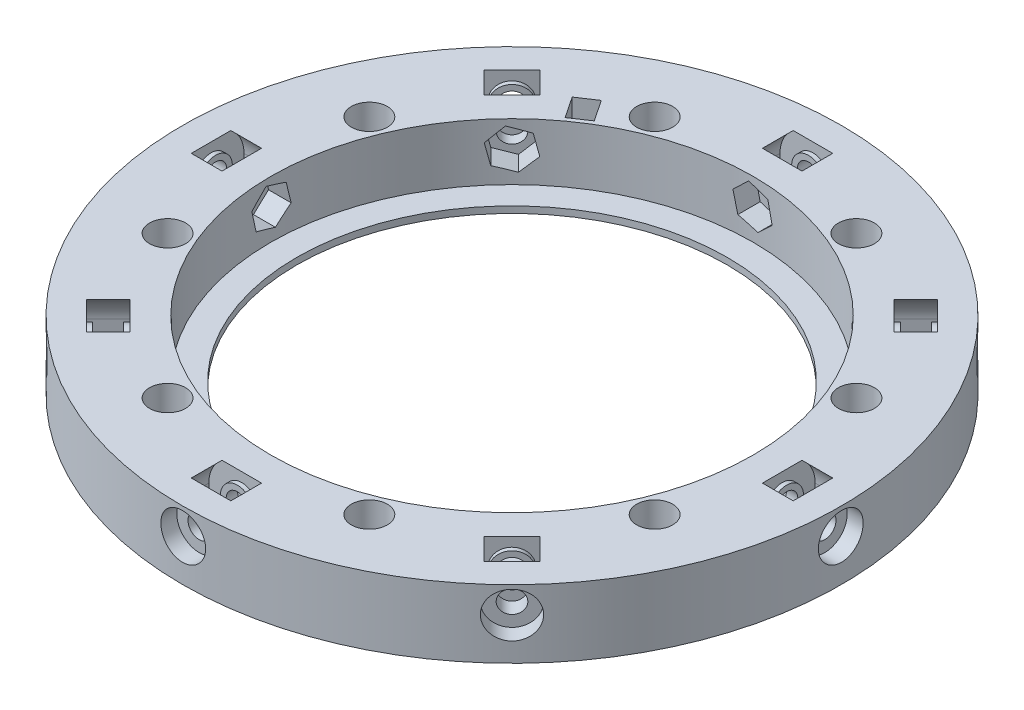
from build123d import *

# Parameters (mm, degrees)
SKETCH1_R                = 75
SKETCH1_R_2              = 54.925
EXTRUDE_THIN1_DEPTH      = 15.5
CUT_EXTRUDE1_START       = -6.5
CUT_EXTRUDE1_DEPTH       = 7
SKETCH3_R                = 4.1
CUT_EXTRUDE2_DEPTH       = 7.1
SKETCH4_R                = 2.05
CUT_EXTRUDE3_DEPTH       = 108.192583699
CIRPATTERN2_COUNT        = 8
CUT_EXTRUDE4_REACH       = 170.42
CUT_EXTRUDE4_END_RADIUS  = 54.925
SKETCH5_R                = 2.55
SKETCH6_R                = 5.1
CUT_EXTRUDE5_DEPTH       = 3.8
CUT_EXTRUDE6_REACH       = 185.52
CUT_EXTRUDE6_END_RADIUS  = 54.925
CUT_EXTRUDE6_START       = -15.1
BOSS_EXTRUDE1_DEPTH      = 1
BOSS_EXTRUDE1_DEPTH_BACK = 1
BOSS_EXTRUDE1_START      = -6.5
SKETCH8_R                = 3.85
SKETCH8_R_2              = 2.55
BOSS_EXTRUDE2_DEPTH      = 1
BOSS_EXTRUDE2_DEPTH_BACK = 1
BOSS_EXTRUDE2_START      = -13.5
SKETCH9_R                = 3.85
SKETCH9_R_2              = 2.55
CIRPATTERN5_COUNT        = 8
CIRPATTERN13_COUNT       = 8
CUT_EXTRUDE8_DEPTH       = 3.66
CUT_EXTRUDE9_REACH       = 108.725
BOSS_EXTRUDE3_START      = -1
SKETCH13_R               = 54.925
SKETCH13_R_2             = 49
BOSS_EXTRUDE3_DEPTH      = 1.5


with BuildPart() as part:
    # Sketch1 → Extrude-Thin1 (new body)
    with BuildSketch(Plane(origin=(0, 0, 0), x_dir=(1, 0, 0), z_dir=(0, 1, 0))):
        Circle(SKETCH1_R)
        Circle(SKETCH1_R_2, mode=Mode.SUBTRACT)
    extrude(amount=EXTRUDE_THIN1_DEPTH)

    # Sketch2 → Cut-Extrude1 (cut)
    with BuildSketch(Plane.XY.offset(75).offset(CUT_EXTRUDE1_START)):
        with BuildLine():
            Line((-7.5, 9.5), (-7.5, 0))
            Line((-7.5, 0), (7.5, 0))
            Line((7.5, 0), (7.5, 9.5))
            ThreePointArc((7.5, 9.5), (0, 17), (-7.5, 9.5))
        make_face()
    cut_extrude1 = extrude(amount=-CUT_EXTRUDE1_DEPTH, mode=Mode.SUBTRACT)

    # Sketch3 → Cut-Extrude2 (cut)
    with BuildSketch(Plane(origin=(0, 15.5, 0), x_dir=(1, 0, 0), z_dir=(0, 1, 0))):
        with Locations(Location((-22.961005942, 55.432771951, 0), (0, 0, 270))):
            Circle(SKETCH3_R)
    cut_extrude2 = extrude(amount=-CUT_EXTRUDE2_DEPTH, mode=Mode.SUBTRACT)

    # Sketch4 → Cut-Extrude3 (cut, through all)
    with BuildSketch(Plane(origin=(0, 15.5, 0), x_dir=(1, 0, 0), z_dir=(0, 1, 0))):
        with Locations(Location((-22.961005942, 55.432771951, 0), (0, 0, 270))):
            Circle(SKETCH4_R)
    cut_extrude3 = extrude(amount=-CUT_EXTRUDE3_DEPTH, mode=Mode.SUBTRACT)

    # CirPattern2: Cut-Extrude2, Cut-Extrude3 ×8 about axis
    cirpattern2_axis = Axis((0, 0, 0), (0, 1, 0))
    add([cut_extrude2.rotate(cirpattern2_axis, i * 360 / CIRPATTERN2_COUNT) for i in range(1, CIRPATTERN2_COUNT)], mode=Mode.SUBTRACT)
    add([cut_extrude3.rotate(cirpattern2_axis, i * 360 / CIRPATTERN2_COUNT) for i in range(1, CIRPATTERN2_COUNT)], mode=Mode.SUBTRACT)

    # Cut-Extrude4: up to this cylinder (the profile starts outside it)
    cut_extrude4_end = Plane(origin=(0, 9.5, 0), z_dir=(0, -1, 0)) * Cylinder(CUT_EXTRUDE4_END_RADIUS, 451.69, mode=Mode.PRIVATE)
    # Sketch5 → Cut-Extrude4 (cut, up to the surface)
    with BuildSketch(Plane.XY.offset(75), mode=Mode.PRIVATE) as cut_extrude4_sk1:
        with Locations((0, 9.5)):
            Circle(SKETCH5_R)
    cut_extrude4_tool1 = extrude(cut_extrude4_sk1.sketch, amount=-CUT_EXTRUDE4_REACH, mode=Mode.PRIVATE) - cut_extrude4_end
    cut_extrude4 = cut_extrude4_tool1.solids().sort_by_distance((0, 9.5, 75))[0]
    add(cut_extrude4, mode=Mode.SUBTRACT)

    # Sketch6 → Cut-Extrude5 (cut)
    with BuildSketch(Plane.XY.offset(75)):
        with Locations((0, 9.5)):
            Circle(SKETCH6_R)
    cut_extrude5 = extrude(amount=-CUT_EXTRUDE5_DEPTH, mode=Mode.SUBTRACT)

    # Cut-Extrude6: up to this cylinder (the profile starts outside it)
    cut_extrude6_end = Plane(origin=(0, 9.5, 0), z_dir=(0, -1, 0)) * Cylinder(CUT_EXTRUDE6_END_RADIUS, 481.89, mode=Mode.PRIVATE)
    # Sketch7 → Cut-Extrude6 (cut, up to the surface)
    with BuildSketch(Plane.XY.offset(75).offset(CUT_EXTRUDE6_START), mode=Mode.PRIVATE) as cut_extrude6_sk1:
        Polygon((-4.473486829, 8.136946226), (-1.05630422, 4.944319876), (3.417182609, 6.30737365), (4.473486829, 10.863053774), (1.05630422, 14.055680124), (-3.417182609, 12.69262635), align=None)
    cut_extrude6_tool1 = extrude(cut_extrude6_sk1.sketch, amount=-CUT_EXTRUDE6_REACH, mode=Mode.PRIVATE) - cut_extrude6_end
    cut_extrude6 = cut_extrude6_tool1.solids().sort_by_distance((0, 9.5, 59.9))[0]
    add(cut_extrude6, mode=Mode.SUBTRACT)

    # CirPattern5: Cut-Extrude1, Cut-Extrude4, Cut-Extrude5, Cut-Extrude6 ×8 about axis
    cirpattern5_axis = Axis((0, 0, 0), (0, 1, 0))
    add([cut_extrude1.rotate(cirpattern5_axis, i * 360 / CIRPATTERN5_COUNT) for i in range(1, CIRPATTERN5_COUNT)], mode=Mode.SUBTRACT)
    add([cut_extrude4.rotate(cirpattern5_axis, i * 360 / CIRPATTERN5_COUNT) for i in range(1, CIRPATTERN5_COUNT)], mode=Mode.SUBTRACT)
    add([cut_extrude5.rotate(cirpattern5_axis, i * 360 / CIRPATTERN5_COUNT) for i in range(1, CIRPATTERN5_COUNT)], mode=Mode.SUBTRACT)
    add([cut_extrude6.rotate(cirpattern5_axis, i * 360 / CIRPATTERN5_COUNT) for i in range(1, CIRPATTERN5_COUNT)], mode=Mode.SUBTRACT)


with BuildPart() as body_2:
    # Sketch8 → Boss-Extrude1 (new, two sides: drawn at the far end of the back side and taken through both)
    with BuildSketch(Plane.XY.offset(75).offset(BOSS_EXTRUDE1_START - BOSS_EXTRUDE1_DEPTH_BACK)):
        with Locations((0, 9.5)):
            Circle(SKETCH8_R)
        with Locations((0, 9.5)):
            Circle(SKETCH8_R_2, mode=Mode.SUBTRACT)
    extrude(amount=BOSS_EXTRUDE1_DEPTH + BOSS_EXTRUDE1_DEPTH_BACK)


with BuildPart() as body_3:
    # Sketch9 → Boss-Extrude2 (new, two sides: drawn at the far end of the back side and taken through both)
    with BuildSketch(Plane.XY.offset(75).offset(BOSS_EXTRUDE2_START - BOSS_EXTRUDE2_DEPTH_BACK)):
        with Locations((0, 9.5)):
            Circle(SKETCH9_R)
        with Locations((0, 9.5)):
            Circle(SKETCH9_R_2, mode=Mode.SUBTRACT)
    extrude(amount=BOSS_EXTRUDE2_DEPTH + BOSS_EXTRUDE2_DEPTH_BACK)


with BuildPart() as cirpattern13_1:
    # CirPattern13: pattern copy
    add(body_2.part.rotate(Axis((0, 0, 0), (0, 1, 0)), 1 * 360 / CIRPATTERN13_COUNT))


with BuildPart() as cirpattern13_2:
    # CirPattern13: pattern copy
    add(body_2.part.rotate(Axis((0, 0, 0), (0, 1, 0)), 2 * 360 / CIRPATTERN13_COUNT))


with BuildPart() as cirpattern13_3:
    # CirPattern13: pattern copy
    add(body_2.part.rotate(Axis((0, 0, 0), (0, 1, 0)), 3 * 360 / CIRPATTERN13_COUNT))


with BuildPart() as cirpattern13_4:
    # CirPattern13: pattern copy
    add(body_2.part.rotate(Axis((0, 0, 0), (0, 1, 0)), 4 * 360 / CIRPATTERN13_COUNT))


with BuildPart() as cirpattern13_5:
    # CirPattern13: pattern copy
    add(body_2.part.rotate(Axis((0, 0, 0), (0, 1, 0)), 5 * 360 / CIRPATTERN13_COUNT))


with BuildPart() as cirpattern13_6:
    # CirPattern13: pattern copy
    add(body_2.part.rotate(Axis((0, 0, 0), (0, 1, 0)), 6 * 360 / CIRPATTERN13_COUNT))


with BuildPart() as cirpattern13_7:
    # CirPattern13: pattern copy
    add(body_2.part.rotate(Axis((0, 0, 0), (0, 1, 0)), 7 * 360 / CIRPATTERN13_COUNT))


with BuildPart() as cirpattern13_8:
    # CirPattern13: pattern copy
    add(body_3.part.rotate(Axis((0, 0, 0), (0, 1, 0)), 1 * 360 / CIRPATTERN13_COUNT))


with BuildPart() as cirpattern13_9:
    # CirPattern13: pattern copy
    add(body_3.part.rotate(Axis((0, 0, 0), (0, 1, 0)), 2 * 360 / CIRPATTERN13_COUNT))


with BuildPart() as cirpattern13_10:
    # CirPattern13: pattern copy
    add(body_3.part.rotate(Axis((0, 0, 0), (0, 1, 0)), 3 * 360 / CIRPATTERN13_COUNT))


with BuildPart() as cirpattern13_11:
    # CirPattern13: pattern copy
    add(body_3.part.rotate(Axis((0, 0, 0), (0, 1, 0)), 4 * 360 / CIRPATTERN13_COUNT))


with BuildPart() as cirpattern13_12:
    # CirPattern13: pattern copy
    add(body_3.part.rotate(Axis((0, 0, 0), (0, 1, 0)), 5 * 360 / CIRPATTERN13_COUNT))


with BuildPart() as cirpattern13_13:
    # CirPattern13: pattern copy
    add(body_3.part.rotate(Axis((0, 0, 0), (0, 1, 0)), 6 * 360 / CIRPATTERN13_COUNT))


with BuildPart() as cirpattern13_14:
    # CirPattern13: pattern copy
    add(body_3.part.rotate(Axis((0, 0, 0), (0, 1, 0)), 7 * 360 / CIRPATTERN13_COUNT))


with BuildPart() as body_2_1:
    add(body_2.part)

    # Combine1: union body 3, CirPattern13_6, CirPattern13_12, CirPattern13_1, CirPattern13_7, CirPattern13_13, CirPattern13_2, CirPattern13_8, CirPattern13_14, CirPattern13_3, part, CirPattern13_9, CirPattern13_4, CirPattern13_10, CirPattern13_5, CirPattern13_11
    add(body_3.part)
    add(cirpattern13_6.part)
    add(cirpattern13_12.part)
    add(cirpattern13_1.part)
    add(cirpattern13_7.part)
    add(cirpattern13_13.part)
    add(cirpattern13_2.part)
    add(cirpattern13_8.part)
    add(cirpattern13_14.part)
    add(cirpattern13_3.part)
    add(part.part)
    add(cirpattern13_9.part)
    add(cirpattern13_4.part)
    add(cirpattern13_10.part)
    add(cirpattern13_5.part)
    add(cirpattern13_11.part)

    # Sketch11 → Cut-Extrude8 (cut)
    with BuildSketch(Plane(origin=(0, 15.5, 0), x_dir=(1, 0, 0), z_dir=(0, 1, 0))):
        Polygon((-33.007476334, 45.097292946), (-29.033051587, 47.75291866), (-31.716455813, 51.768916887), (-32.272026046, 52.6003865), (-36.246450793, 49.944760786), (-35.69088056, 49.113291173), align=None)
    extrude(amount=-CUT_EXTRUDE8_DEPTH, mode=Mode.SUBTRACT)

    # Sketch12 → Cut-Extrude9 (cut, up to next)
    with BuildSketch(Plane(origin=(0, 11.84, 0), x_dir=(1, 0, 0), z_dir=(0, 1, 0)), mode=Mode.PRIVATE) as cut_extrude9_sk1:
        Polygon((-36.246450793, 49.944760786), (-32.272026046, 52.6003865), (-31.716455813, 51.768916887), (-35.69088056, 49.113291173), align=None)
    cut_extrude9_tool1 = extrude(cut_extrude9_sk1.sketch, amount=-CUT_EXTRUDE9_REACH, mode=Mode.PRIVATE) & body_2_1.part
    add(cut_extrude9_tool1.solids().sort_by_distance((-33.981453, 11.84, -50.856839))[0], mode=Mode.SUBTRACT)

    # Sketch13 → Boss-Extrude3 (add)
    with BuildSketch(Plane.XZ.offset(BOSS_EXTRUDE3_START)):
        with Locations(Location((0, 0, 0), (0, 0, 270))):
            Circle(SKETCH13_R)
        with Locations(Location((0, 0, 0), (0, 0, 270))):
            Circle(SKETCH13_R_2, mode=Mode.SUBTRACT)
    extrude(amount=-BOSS_EXTRUDE3_DEPTH)


solid = body_2_1.part
